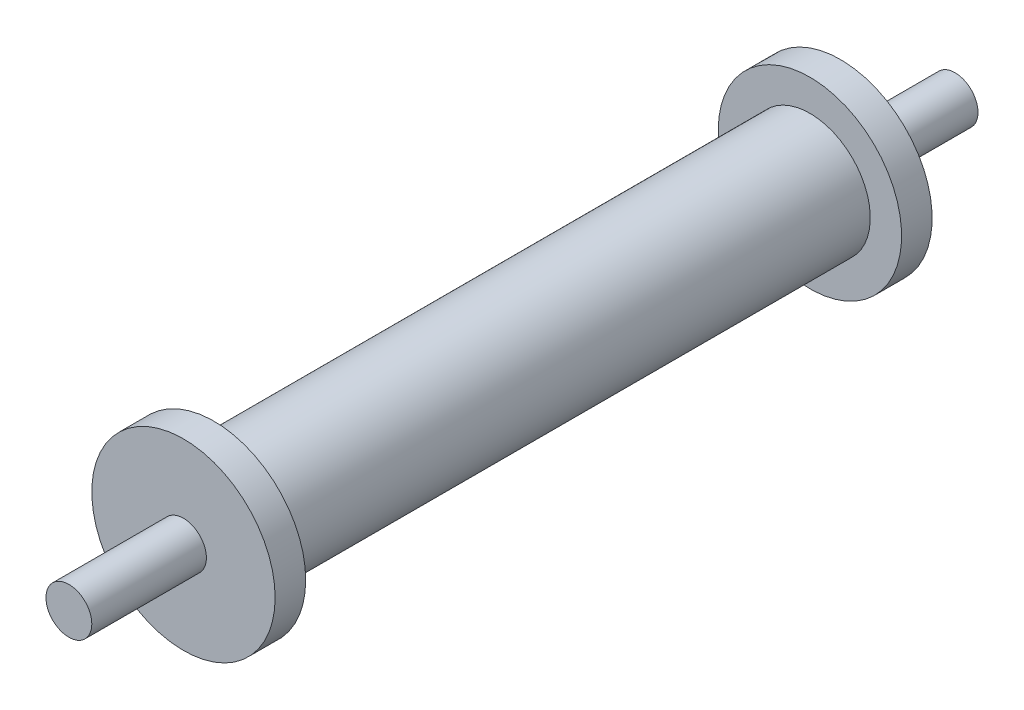
from build123d import *

# Parameters (mm, degrees)
SKETCH1_R           = 3.95
BOSS_EXTRUDE1_DEPTH = 58
SKETCH2_R           = 6
BOSS_EXTRUDE2_DEPTH = 2
BOSS_EXTRUDE3_START = -2
SKETCH3_R           = 6
BOSS_EXTRUDE3_DEPTH = 2
SKETCH4_R           = 4.307153401
SKETCH4_R_2         = 1.5
CUT_EXTRUDE1_DEPTH  = 10
CUT_EXTRUDE2_START  = 10
SKETCH5_R           = 5.180652983
SKETCH5_R_2         = 1.5
CUT_EXTRUDE2_DEPTH  = 10


with BuildPart() as part:
    # Sketch1 → Boss-Extrude1 (new body)
    with BuildSketch(Plane.XY):
        with Locations(Location((0, 0, 0), (0, 0, 180))):
            Circle(SKETCH1_R)
    extrude(amount=BOSS_EXTRUDE1_DEPTH)

    # Sketch2 → Boss-Extrude2 (add)
    with BuildSketch(Plane.XY.offset(50.5)):
        Circle(SKETCH2_R)
    extrude(amount=-BOSS_EXTRUDE2_DEPTH)

    # Sketch3 → Boss-Extrude3 (add)
    with BuildSketch(Plane(origin=(0, 0, 7.5), x_dir=(-1, 0, 0), z_dir=(0, 0, -1)).offset(BOSS_EXTRUDE3_START)):
        with Locations(Location((0, 0, 0), (0, 0, 180))):
            Circle(SKETCH3_R)
    extrude(amount=BOSS_EXTRUDE3_DEPTH)

    # Sketch4 → Cut-Extrude1 (cut)
    with BuildSketch(Plane.XY.offset(50.5)):
        Circle(SKETCH4_R)
        Circle(SKETCH4_R_2, mode=Mode.SUBTRACT)
    extrude(amount=CUT_EXTRUDE1_DEPTH, mode=Mode.SUBTRACT)

    # Sketch5 → Cut-Extrude2 (cut)
    with BuildSketch(Plane(origin=(0, 0, 7.5), x_dir=(-1, 0, 0), z_dir=(0, 0, -1)).offset(CUT_EXTRUDE2_START)):
        Circle(SKETCH5_R)
        with Locations(Location((0, 0, 0), (0, 0, 180))):
            Circle(SKETCH5_R_2, mode=Mode.SUBTRACT)
    extrude(amount=-CUT_EXTRUDE2_DEPTH, mode=Mode.SUBTRACT)


solid = part.part
